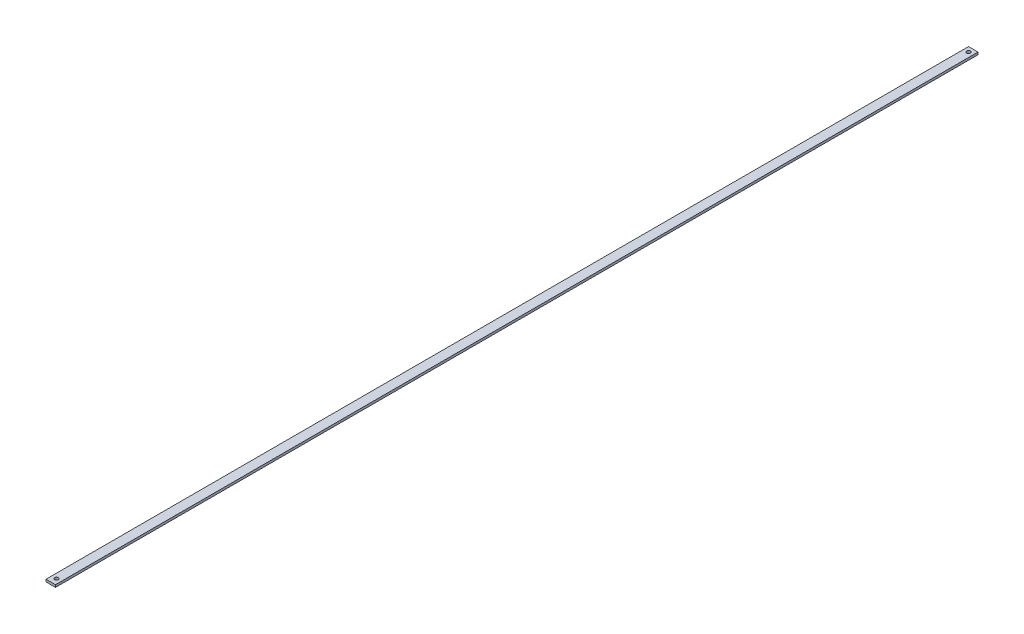
from build123d import *

# Parameters (mm, degrees)
SKETCH1_W                = 25.4
SKETCH1_H                = 6.35
BOSS_EXTRUDE1_DEPTH      = 2470.15
X_0_397_DIAMETER_HOLE1_D = 10.0838
X_0_397_DIAMETER_HOLE2_D = 10.0838


with BuildPart() as part:
    # Sketch1 → Boss-Extrude1 (new body)
    with BuildSketch(Plane.XY):
        with Locations((12.7, 3.175)):
            Rectangle(SKETCH1_W, SKETCH1_H)
    extrude(amount=BOSS_EXTRUDE1_DEPTH)

    # X (0.397) Diameter Hole1 (through all)
    with Locations(Plane(origin=(0, 6.35, 0), x_dir=(1, 0, 0), z_dir=(0, 1, 0))):
        with Locations((12.7, -12.7)):
            Hole(X_0_397_DIAMETER_HOLE1_D / 2)

    # X (0.397) Diameter Hole2 (through all)
    with Locations(Plane(origin=(0, 0, 0), x_dir=(-1, 0, 0), z_dir=(0, -1, 0))):
        with Locations((-12.7, -2454.751490121)):
            Hole(X_0_397_DIAMETER_HOLE2_D / 2)


solid = part.part
